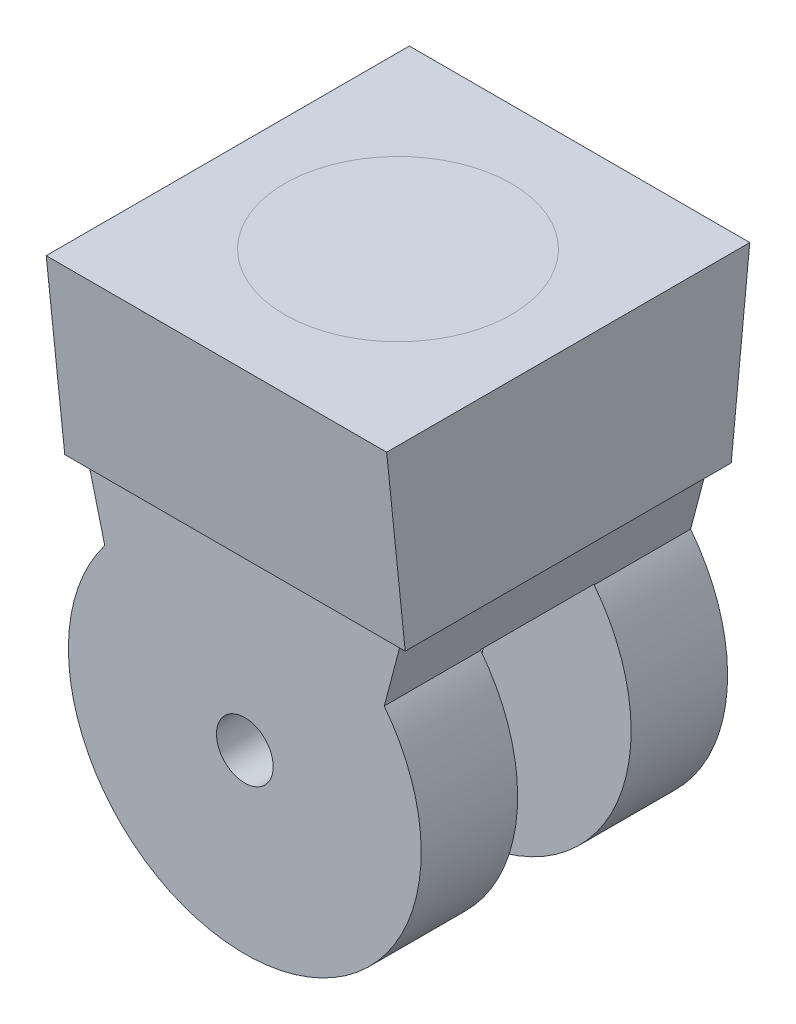
from build123d import *

# Parameters (mm, degrees)
SALIENTE_EXTRUIR1_DEPTH = 38.1
SALIENTE_EXTRUIR2_DEPTH = 34.29
CROQUIS3_R              = 39.658757808
CORTAR_EXTRUIR1_DEPTH   = 12.7
CROQUIS4_R              = 6.35
CORTAR_EXTRUIR2_DEPTH   = 131.416915542


with BuildPart() as part:
    # Croquis1 → Saliente-Extruir1 (new, symmetric)
    with BuildSketch(Plane(origin=(0, 0, 0), x_dir=(0, 0, -1), z_dir=(1, 0, 0))):
        Polygon((-40.64, 20.319999995), (-36.486122257, -20.319999995), (0, -20.319999995), (36.486122257, -20.319999995), (40.64, 20.319999995), align=None)
    extrude(amount=SALIENTE_EXTRUIR1_DEPTH, both=True)

    # Croquis2 → Saliente-Extruir2 (add, symmetric)
    with BuildSketch(Plane.XY):
        with BuildLine():
            Line((35.223664747, -20.319999995), (31.209635447, -35.506729715))
            ThreePointArc((31.209635447, -35.506729715), (0.114127167, -99.172386969), (-31.348920302, -35.687560492))
            Line((-31.348920302, -35.687560492), (-35.223664747, -20.319999995))
            Line((-35.223664747, -20.319999995), (35.223664747, -20.319999995))
        make_face()
    extrude(amount=SALIENTE_EXTRUIR2_DEPTH, both=True)

    # Croquis3 → Cortar-Extruir1 (cut, symmetric)
    with BuildSketch(Plane.XY):
        with Locations((0, -59.689999995)):
            Circle(CROQUIS3_R)
    extrude(amount=CORTAR_EXTRUIR1_DEPTH, both=True, mode=Mode.SUBTRACT)

    # Croquis4 → Cortar-Extruir2 (cut, through all)
    with BuildSketch(Plane.XY.offset(34.29)):
        with Locations((0, -59.689999995)):
            Circle(CROQUIS4_R)
    extrude(amount=-CORTAR_EXTRUIR2_DEPTH, mode=Mode.SUBTRACT)


solid = part.part
